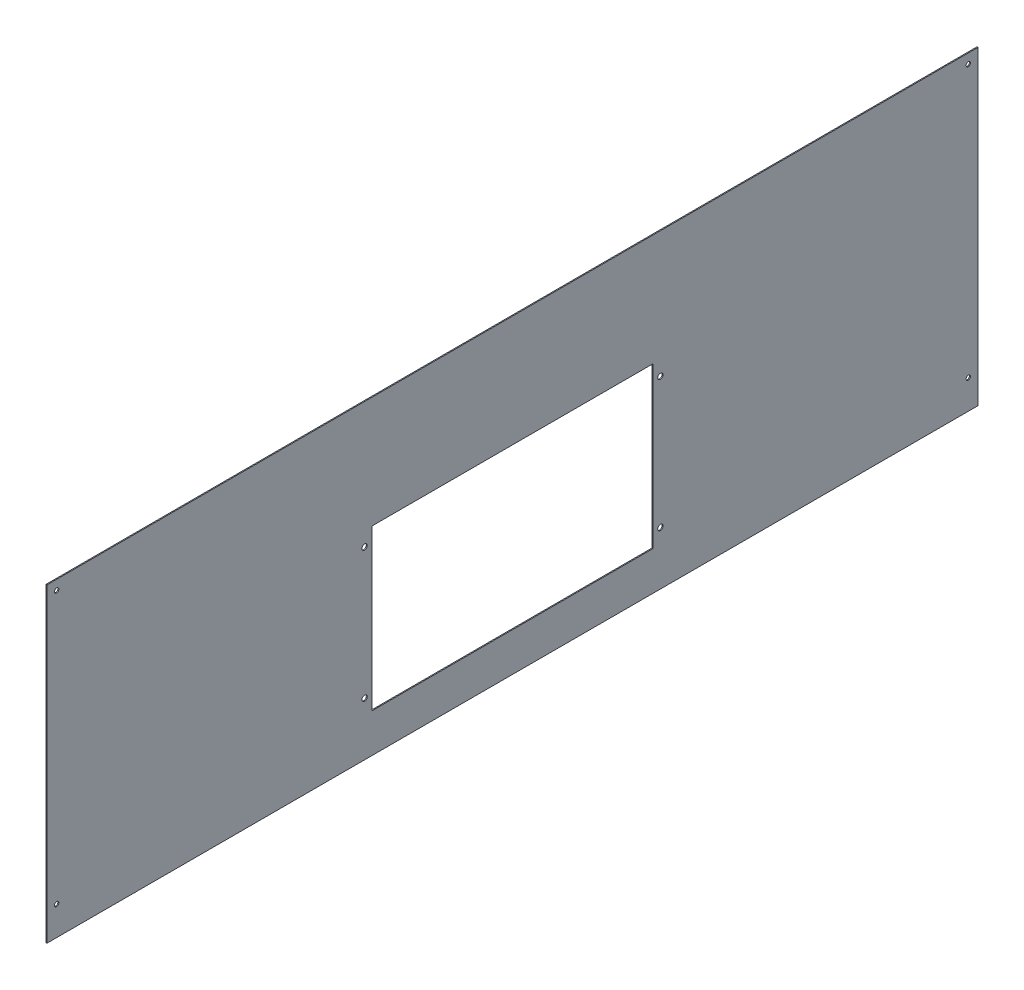
from build123d import *

# Parameters (mm, degrees)
SKETCH1_W   = 1920
SKETCH1_H   = 640
SKETCH1_R   = 4.5
SKETCH1_R_2 = 5.5
SKETCH1_W_2 = 580
SKETCH1_H_2 = 330
THICKEN1_T1 = 2


with BuildPart() as body_1:
    # Sketch1 → Surface-Plane1: a flat surface bounded by the sketch
    with BuildSketch(Plane(origin=(0, 0, 0), x_dir=(0, 0, -1), z_dir=(1, 0, 0)), mode=Mode.PRIVATE) as surface_plane1_1_region:
        Rectangle(SKETCH1_W, SKETCH1_H)
        with Locations((-940, 300)):
            Circle(SKETCH1_R, mode=Mode.SUBTRACT)
        with Locations((940, 300)):
            Circle(SKETCH1_R, mode=Mode.SUBTRACT)
        with Locations((940, -260)):
            Circle(SKETCH1_R, mode=Mode.SUBTRACT)
        with Locations((-940, -260)):
            Circle(SKETCH1_R, mode=Mode.SUBTRACT)
        with Locations((-305, 60)):
            Circle(SKETCH1_R_2, mode=Mode.SUBTRACT)
        with Locations((305, 60)):
            Circle(SKETCH1_R_2, mode=Mode.SUBTRACT)
        with Locations((305, -210)):
            Circle(SKETCH1_R_2, mode=Mode.SUBTRACT)
        with Locations((-305, -210)):
            Circle(SKETCH1_R_2, mode=Mode.SUBTRACT)
        with Locations((0, -75)):
            Rectangle(SKETCH1_W_2, SKETCH1_H_2, mode=Mode.SUBTRACT)
    surface_plane1_1 = surface_plane1_1_region.sketch.faces()[0]
    add(Solid.thicken(surface_plane1_1, THICKEN1_T1))


solid = body_1.part
